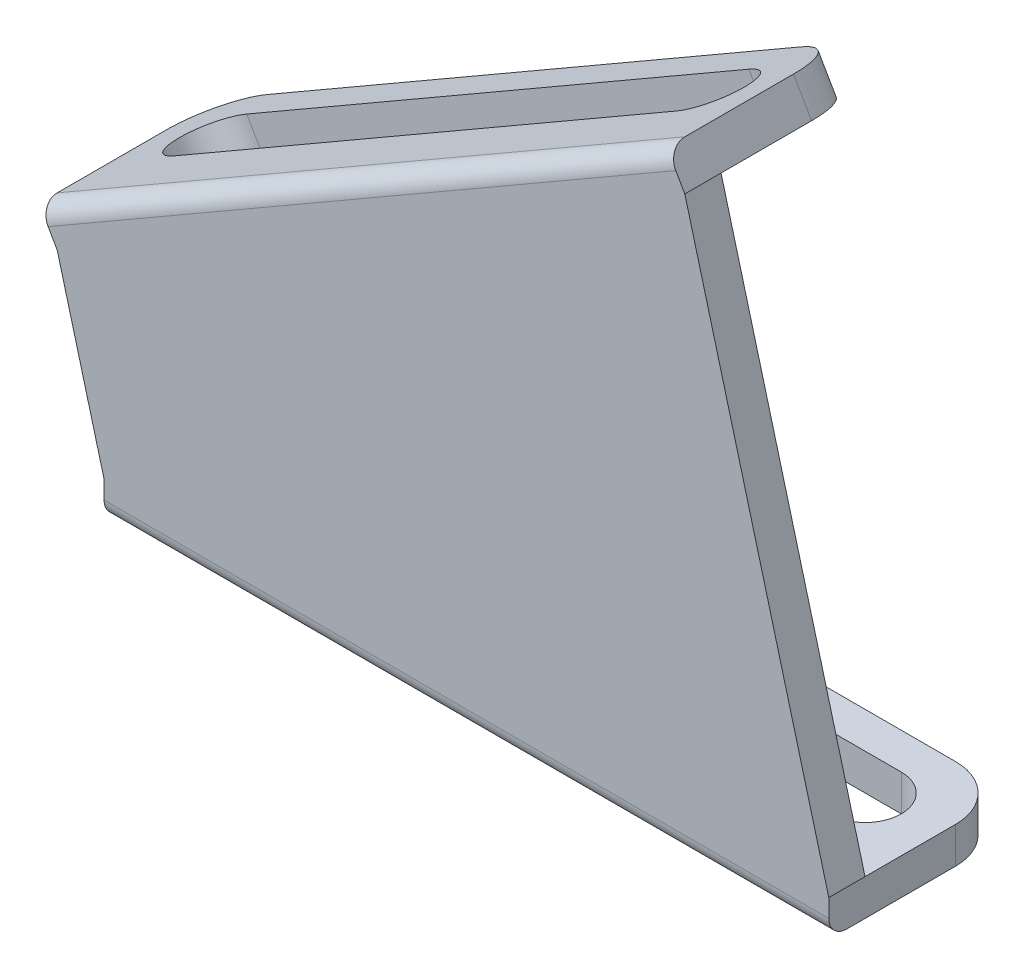
from build123d import *

# Parameters (mm, degrees)
BOSS_EXTRUDE2_DEPTH = 2
BOSS_EXTRUDE3_DEPTH = 2
BOSS_EXTRUDE4_DEPTH = 2
FILLET1_R           = 1
FILLET2_R           = 1


with BuildPart() as part:
    # Sketch1 → Boss-Extrude2 (new body)
    with BuildSketch(Plane(origin=(0, 0, 0), x_dir=(1, 0, 0), z_dir=(0, 1, 0))):
        with BuildLine():
            Line((0, 0), (40, 0))
            Line((40, 0), (40, 7))
            ThreePointArc((40, 7), (39.121320344, 9.121320344), (37, 10))
            Line((37, 10), (3, 10))
            ThreePointArc((3, 10), (0.878679656, 9.121320344), (0, 7))
            Line((0, 7), (0, 0))
        make_face()
        with BuildLine():
            Line((4, 8), (36, 8))
            ThreePointArc((36, 8), (38, 6), (36, 4))
            Line((36, 4), (4, 4))
            ThreePointArc((4, 4), (2, 6), (4, 8))
        make_face(mode=Mode.SUBTRACT)
    extrude(amount=BOSS_EXTRUDE2_DEPTH)

    # Sketch2 → Boss-Extrude3 (add)
    with BuildSketch(Plane.XY):
        Polygon((0, 2), (-2.588190451, 11.659258263), (32.0528257, 31.659258263), (40, 2), align=None)
    extrude(amount=-BOSS_EXTRUDE3_DEPTH)

    # Sketch3 → Boss-Extrude4 (add)
    with BuildSketch(Plane(origin=(-5.695654535, 9.865163037, 0), x_dir=(0.866025403784438, 0.5000000000000012, 0), z_dir=(-0.5000000000000012, 0.866025403784438, 0))):
        with BuildLine():
            Line((3.588190451, 0), (43.588190451, 0))
            Line((43.588190451, 0), (43.588190451, 7))
            ThreePointArc((43.588190451, 7), (42.709510795, 9.121320344), (40.588190451, 10))
            Line((40.588190451, 10), (6.588190451, 10))
            ThreePointArc((6.588190451, 10), (4.466870107, 9.121320344), (3.588190451, 7))
            Line((3.588190451, 7), (3.588190451, 0))
        make_face()
        with BuildLine():
            Line((7.588190451, 4), (39.588190451, 4))
            ThreePointArc((39.588190451, 4), (41.588190451, 6), (39.588190451, 8))
            Line((39.588190451, 8), (7.588190451, 8))
            ThreePointArc((7.588190451, 8), (5.588190451, 6), (7.588190451, 4))
        make_face(mode=Mode.SUBTRACT)
    extrude(amount=BOSS_EXTRUDE4_DEPTH)

    # Fillet1
    fillet1_edges = [part.edges().sort_by_distance(p)[0] for p in [
        (20, 0, 0),
    ]]
    fillet(fillet1_edges, radius=FILLET1_R)

    # Fillet2
    fillet2_edges = [part.edges().sort_by_distance(p)[0] for p in [
        (13.732317625, 23.39130907, 0),
    ]]
    fillet(fillet2_edges, radius=FILLET2_R)


solid = part.part
